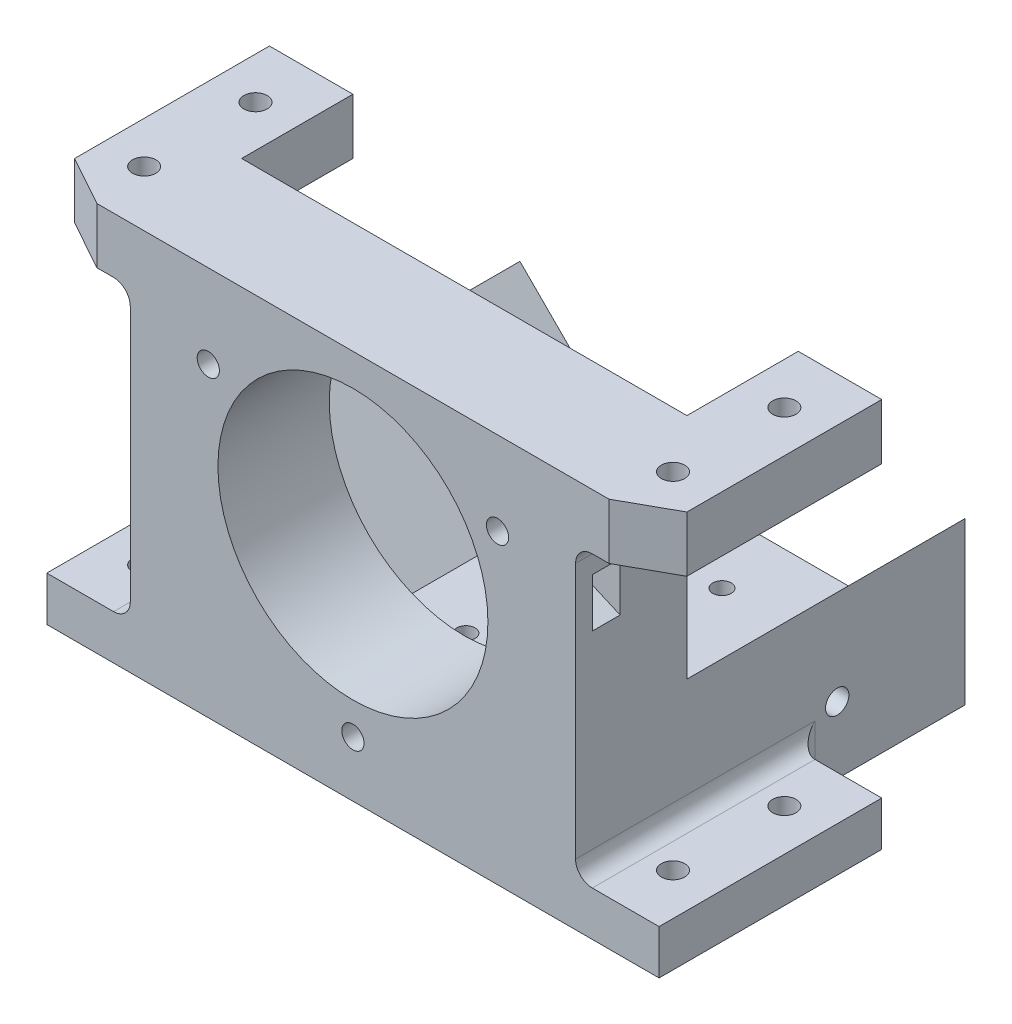
from build123d import *

# Parameters (mm, degrees)
SKETCH1_W           = 80
SKETCH1_H           = 60
SKETCH1_R           = 24.25
BOSS_EXTRUDE1_DEPTH = 20
BOSS_EXTRUDE3_DEPTH = 15
SKETCH5_R           = 2.1
CUT_EXTRUDE2_DEPTH  = 10
SKETCH6_W           = 80
SKETCH6_H           = 20
BOSS_EXTRUDE4_DEPTH = 2
BOSS_EXTRUDE6_DEPTH = 50
SKETCH9_R           = 2.1
CUT_EXTRUDE3_DEPTH  = 100.619275243
SKETCH12_W          = 80
SKETCH12_H          = 70
SKETCH12_R          = 1.65
BOSS_EXTRUDE8_DEPTH = 8
BOSS_EXTRUDE9_DEPTH = 15
CUT_EXTRUDE4_START  = -10
SKETCH14_R          = 2.1
CUT_EXTRUDE4_DEPTH  = 10
SKETCH16_R          = 2
CUT_EXTRUDE5_DEPTH  = 3
CIRPATTERN1_COUNT   = 3
FILLET1_R           = 3
CUT_EXTRUDE6_DEPTH  = 5


with BuildPart() as part:
    # Sketch1 → Boss-Extrude1 (new body)
    with BuildSketch(Plane.XY):
        Rectangle(SKETCH1_W, SKETCH1_H)
        Circle(SKETCH1_R, mode=Mode.SUBTRACT)
    extrude(amount=BOSS_EXTRUDE1_DEPTH)

    # Sketch4 → Boss-Extrude3 (add)
    with BuildSketch(Plane(origin=(40, 0, 0), x_dir=(0, 0, -1), z_dir=(1, 0, 0))):
        Polygon((-20, 30), (0, 30), (20, 30), (20, 20), (0, 20), (-20, 20), align=None)
    boss_extrude3 = extrude(amount=BOSS_EXTRUDE3_DEPTH)

    # Sketch5 → Cut-Extrude2 (cut)
    with BuildSketch(Plane(origin=(0, 30, 0), x_dir=(1, 0, 0), z_dir=(0, 1, 0))):
        with Locations(Location((47.5, -10, 0), (0, 0, 270))):
            Circle(SKETCH5_R)
        with Locations(Location((47.5, 10, 0), (0, 0, 270))):
            Circle(SKETCH5_R)
        Polygon((46, -20), (55, -15), (55, -20), align=None)
    cut_extrude2 = extrude(amount=-CUT_EXTRUDE2_DEPTH, mode=Mode.SUBTRACT)

    # Sketch6 → Boss-Extrude4 (add)
    with BuildSketch(Plane(origin=(0, -30, 0), x_dir=(-1, 0, 0), z_dir=(0, -1, 0))):
        with Locations((0, -10)):
            Rectangle(SKETCH6_W, SKETCH6_H)
    boss_extrude4 = extrude(amount=BOSS_EXTRUDE4_DEPTH)

    # Sketch8 → Boss-Extrude6 (add)
    with BuildSketch(Plane(origin=(0, 0, 0), x_dir=(-1, 0, 0), z_dir=(0, 0, -1))):
        Polygon((-40, -11), (-19, -32), (-40, -32), align=None)
    boss_extrude6 = extrude(amount=BOSS_EXTRUDE6_DEPTH)

    # Sketch9 → Cut-Extrude3 (cut, through all)
    with BuildSketch(Plane(origin=(40, 0, 0), x_dir=(0, 0, -1), z_dir=(1, 0, 0))):
        with Locations((27, -28)):
            Circle(SKETCH9_R)
    cut_extrude3 = extrude(amount=-CUT_EXTRUDE3_DEPTH, mode=Mode.SUBTRACT)

    # Sketch12 → Boss-Extrude8 (add)
    with BuildSketch(Plane.XZ.offset(32)):
        with Locations((0, -15)):
            Rectangle(SKETCH12_W, SKETCH12_H)
        with Locations(Location((-8, -8.3, 0), (0, 0, 270))):
            Circle(SKETCH12_R, mode=Mode.SUBTRACT)
        with Locations(Location((8, -8.3, 0), (0, 0, 270))):
            Circle(SKETCH12_R, mode=Mode.SUBTRACT)
        with Locations(Location((8, -38.3, 0), (0, 0, 270))):
            Circle(SKETCH12_R, mode=Mode.SUBTRACT)
        with Locations(Location((-8, -38.3, 0), (0, 0, 270))):
            Circle(SKETCH12_R, mode=Mode.SUBTRACT)
    extrude(amount=BOSS_EXTRUDE8_DEPTH)

    # Mirror1: Boss-Extrude3, Cut-Extrude2, Boss-Extrude4, Boss-Extrude6, Cut-Extrude3 across plane
    add(boss_extrude3.mirror(Plane(origin=(0, 0, 0), x_dir=(0, 0, 1), z_dir=(1, 0, 0))))
    add(cut_extrude2.mirror(Plane(origin=(0, 0, 0), x_dir=(0, 0, 1), z_dir=(1, 0, 0))), mode=Mode.SUBTRACT)
    add(boss_extrude4.mirror(Plane(origin=(0, 0, 0), x_dir=(0, 0, 1), z_dir=(1, 0, 0))))
    add(boss_extrude6.mirror(Plane(origin=(0, 0, 0), x_dir=(0, 0, 1), z_dir=(1, 0, 0))))
    add(cut_extrude3.mirror(Plane(origin=(0, 0, 0), x_dir=(0, 0, 1), z_dir=(1, 0, 0))), mode=Mode.SUBTRACT)

    # Sketch13 → Boss-Extrude9 (add)
    with BuildSketch(Plane.ZY.offset(40)):
        Polygon((20, -40), (0, -40), (-20, -40), (-20, -32), (0, -32), (20, -32), align=None)
    boss_extrude9 = extrude(amount=BOSS_EXTRUDE9_DEPTH)

    # Sketch14 → Cut-Extrude4 (cut)
    with BuildSketch(Plane.XZ.offset(40).offset(CUT_EXTRUDE4_START)):
        with Locations(Location((-47.5, 10, 0), (0, 0, 90))):
            Circle(SKETCH14_R)
        with Locations(Location((-47.5, -10, 0), (0, 0, 90))):
            Circle(SKETCH14_R)
    cut_extrude4 = extrude(amount=CUT_EXTRUDE4_DEPTH, mode=Mode.SUBTRACT)

    # Mirror2: Boss-Extrude9, Cut-Extrude4 across plane
    add(boss_extrude9.mirror(Plane(origin=(0, 0, 0), x_dir=(0, 0, 1), z_dir=(1, 0, 0))))
    add(cut_extrude4.mirror(Plane(origin=(0, 0, 0), x_dir=(0, 0, 1), z_dir=(1, 0, 0))), mode=Mode.SUBTRACT)

    # Sketch16 → Cut-Extrude5 (cut)
    with BuildSketch(Plane.XY.offset(20)):
        with Locations((0, -30)):
            Circle(SKETCH16_R)
    cut_extrude5 = extrude(amount=-CUT_EXTRUDE5_DEPTH, mode=Mode.SUBTRACT)

    # CirPattern1: Cut-Extrude5 ×3 about axis
    cirpattern1_axis = Axis((0, 0, 0), (0, 0, 1))
    for i in range(1, CIRPATTERN1_COUNT):
        add(cut_extrude5.rotate(cirpattern1_axis, i * 360 / CIRPATTERN1_COUNT), mode=Mode.SUBTRACT)

    # Fillet1
    fillet1_edges = [part.edges().sort_by_distance(p)[0] for p in [
        (-40, 20, 10),
        (-40, -32, 0),
        (-40, -36, -20),
        (40, 20, 10),
        (40, -32, 0),
        (40, -36, -20),
    ]]
    fillet(fillet1_edges, radius=FILLET1_R)

    # Sketch17 → Cut-Extrude6 (cut)
    with BuildSketch(Plane.XY.offset(17)):
        Polygon((-3.6, -32.078460969), (-3.6, -40), (3.6, -40), (3.6, -32.078460969), (3.6, -27.921539031), (0, -25.843078062), (-3.6, -27.921539031), align=None)
        Polygon((29.323026539, 17.47169345), (25.511345008, 19.130332624), (22.169080583, 16.658639174), (22.638497688, 12.52830655), (26.450179219, 10.869667376), (42.459549451, 3.903248909), (45.851836141, 11.698986963), align=None)
        Polygon((-21.915647081, 15.868815152), (-24.70062059, 18.954900464), (-28.765735623, 18.086085312), (-43.679312497, 14.998912364), (-42.219854604, 7.948533961), (-27.260903637, 11.045099536), (-23.195788604, 11.913914688), align=None)
    extrude(amount=-CUT_EXTRUDE6_DEPTH, mode=Mode.SUBTRACT)


solid = part.part
